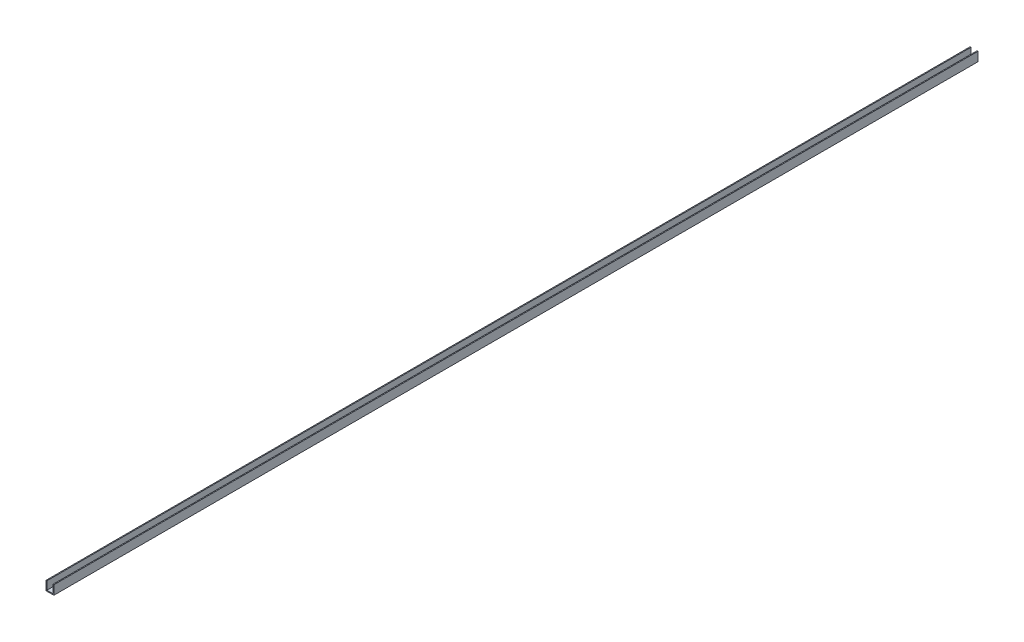
from build123d import *

# Parameters (mm, degrees)
BOSS_EXTRUDE1_DEPTH = 762


with BuildPart() as part:
    # Sketch3 → Boss-Extrude1 (new, symmetric)
    with BuildSketch(Plane.XY):
        Polygon((-6.477, 7.493), (-6.477, -7.493), (6.477, -7.493), (6.477, 7.493), (4.953, 7.493), (4.953, -5.969), (-4.953, -5.969), (-4.953, 7.493), align=None)
    extrude(amount=BOSS_EXTRUDE1_DEPTH, both=True)


solid = part.part
